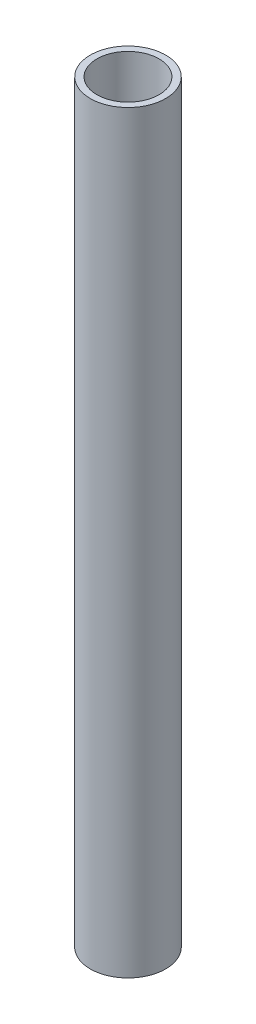
from build123d import *

# Parameters (mm, degrees)
SKETCH2_R               = 2
BOSS_EXTRUDE1_DEPTH     = 20
CUT_EXTRUDE1_DEPTH      = 41.099875312
CUT_EXTRUDE1_DEPTH_BACK = 41.099875312
SKETCH3_R               = 1.65


with BuildPart() as part:
    # Sketch2 → Boss-Extrude1 (new, symmetric)
    with BuildSketch(Plane(origin=(0, 0, 0), x_dir=(1, 0, 0), z_dir=(0, 1, 0))):
        with Locations(Location((0, 0, 0), (0, 0, 270))):
            Circle(SKETCH2_R)
    extrude(amount=BOSS_EXTRUDE1_DEPTH, both=True)

    # Sketch3 → Cut-Extrude1 (cut, two sides: drawn at the far end of the back side and taken through both)
    with BuildSketch(Plane(origin=(0, 20, 0), x_dir=(1, 0, 0), z_dir=(0, 1, 0)).offset(-CUT_EXTRUDE1_DEPTH_BACK)):
        with Locations(Location((0, 0, 0), (0, 0, 270))):
            Circle(SKETCH3_R)
    extrude(amount=CUT_EXTRUDE1_DEPTH + CUT_EXTRUDE1_DEPTH_BACK, mode=Mode.SUBTRACT)


solid = part.part
